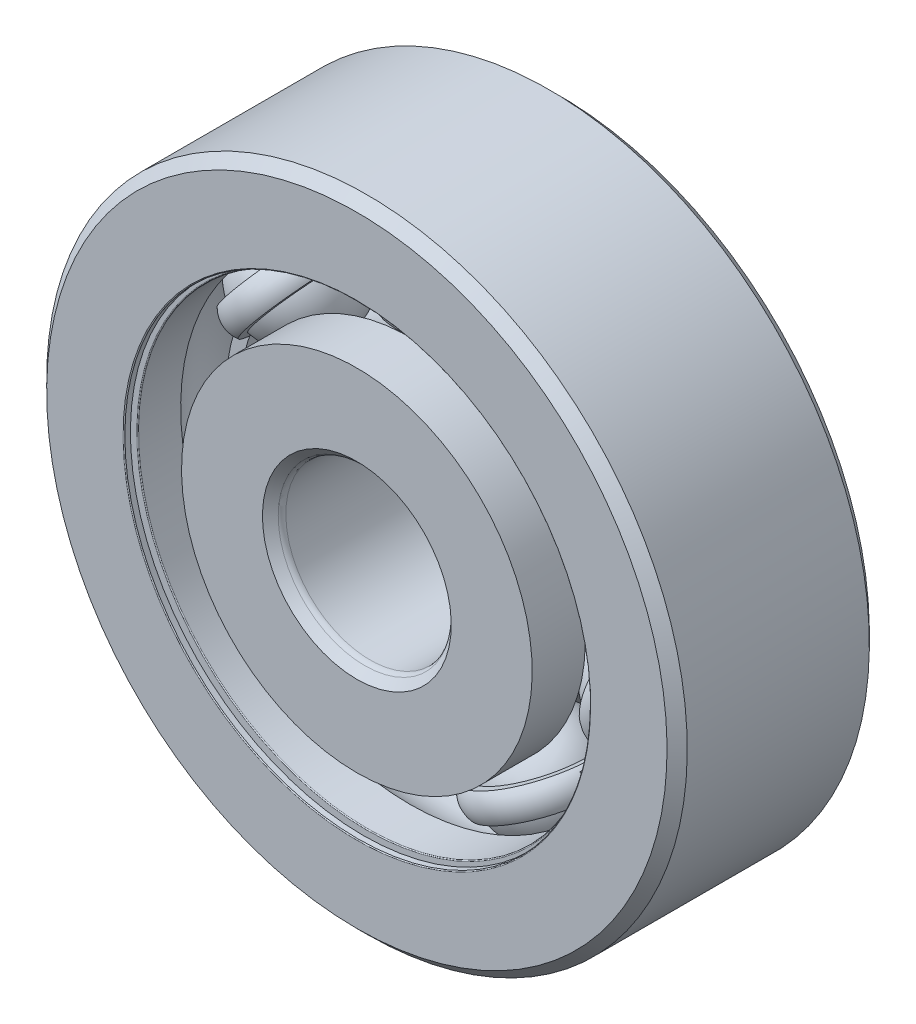
from build123d import *

# Parameters (mm, degrees)
BOSS_EXTRUDE1_DEPTH = 0.5
CIRPATTERN1_COUNT   = 7
CIRPATTERN2_COUNT   = 7
FILLET1_R           = 0.027
FILLET2_R           = 0.225


with BuildPart() as part:
    # Sketch3 → Revolve1 (revolve)
    with BuildSketch(Plane(origin=(0, 0, 0), x_dir=(0, 0, -1), z_dir=(1, 0, 0)), mode=Mode.PRIVATE) as revolve1_sk:
        with BuildLine():
            Line((2.7, 9.5), (3, 9.2))
            Line((3, 9.2), (3, 6.8))
            Line((3, 6.8), (1.425, 6.8))
            ThreePointArc((1.425, 6.8), (0, 7.6342047), (-1.425, 6.8))
            Line((-1.425, 6.8), (-3, 6.8))
            Line((-3, 6.8), (-3, 9.2))
            Line((-3, 9.2), (-2.7, 9.5))
            Line((-2.7, 9.5), (2.7, 9.5))
        make_face()
    revolve(revolve1_sk.sketch.rotate(Axis((0, 0, 3), (0, 0, -1)), 180), axis=Axis((0, 0, 3), (0, 0, -1)))

    # Sketch8 → Cut-Revolve1 (revolve, cut)
    with BuildSketch(Plane(origin=(0, 0, 0), x_dir=(0, 0, -1), z_dir=(1, 0, 0)), mode=Mode.PRIVATE) as cut_revolve1_sk:
        Polygon((-2.808, 6.8), (-2.7, 6.8), (-2.7, 7.7), (-2.808, 7.7), (-2.808, 6.908), (-3, 6.908), (-3, 6.8), align=None)
        Polygon((2.7, 6.8), (2.808, 6.8), (3, 6.8), (3, 6.908), (2.808, 6.908), (2.808, 7.7), (2.7, 7.7), align=None)
    revolve(cut_revolve1_sk.sketch.rotate(Axis((0, 0, 3), (0, 0, -1)), 180), axis=Axis((0, 0, 3), (0, 0, -1)), mode=Mode.SUBTRACT)

    # Fillet1
    fillet1_edges = [part.edges().sort_by_distance(p)[0] for p in [
        (0, 6.908, 3),
        (0, 6.8, 2.7),
        (0, 6.908, -3),
        (0, 6.8, -2.7),
    ]]
    fillet(fillet1_edges, radius=FILLET1_R)


with BuildPart() as body_2:
    # Sketch4 → Revolve2 (revolve)
    with BuildSketch(Plane(origin=(0, 0, 0), x_dir=(0, 0, -1), z_dir=(1, 0, 0)), mode=Mode.PRIVATE) as revolve2_sk:
        with BuildLine():
            Line((-2.7, 2.5), (-3, 2.8))
            Line((-3, 2.8), (-3, 5.2))
            Line((-3, 5.2), (-1.425, 5.2))
            ThreePointArc((-1.425, 5.2), (0, 4.3657953), (1.425, 5.2))
            Line((1.425, 5.2), (3, 5.2))
            Line((3, 5.2), (3, 2.8))
            Line((3, 2.8), (2.7, 2.5))
            Line((2.7, 2.5), (-2.7, 2.5))
        make_face()
    revolve(revolve2_sk.sketch.rotate(Axis((0, 0, 3), (0, 0, -1)), 180), axis=Axis((0, 0, 3), (0, 0, -1)))

    # Fillet2
    fillet2_edges = [body_2.edges().sort_by_distance(p)[0] for p in [
        (0, 2.5, 2.7),
        (0, 2.5, -2.7),
    ]]
    fillet(fillet2_edges, radius=FILLET2_R)


with BuildPart() as body_3:
    # Sketch5 → Revolve3 (revolve)
    with BuildSketch(Plane(origin=(0, 0, 0), x_dir=(0, 0, -1), z_dir=(1, 0, 0))):
        with BuildLine():
            Line((-1.6342047, 6), (1.6342047, 6))
            ThreePointArc((1.6342047, 6), (0, 7.6342047), (-1.6342047, 6))
        make_face()
    revolve(axis=Axis((0, 6, 1.6342047), (0, 0, -1)))


with BuildPart() as body_4:
    # Sketch6 → Revolve4 (revolve)
    with BuildSketch(Plane(origin=(0, 0, 0), x_dir=(0, 0, -1), z_dir=(1, 0, 0))):
        with BuildLine():
            Line((-1.584495188, 6.4), (-1.820412656, 6.4))
            ThreePointArc((-1.820412656, 6.4), (-1.938371391, 6), (-1.820412656, 5.6))
            Line((-1.820412656, 5.6), (-1.584495188, 5.6))
            ThreePointArc((-1.584495188, 5.6), (-1.6342047, 6), (-1.584495188, 6.4))
        make_face()
    revolve4 = revolve(axis=Axis((0, 9.5, 0), (0, -1, 0)))

    # Sketch7 → Boss-Extrude1 (add, symmetric)
    with BuildSketch(Plane.XY):
        with BuildLine():
            Line((4.547477099, 3.914134902), (4.850642239, 4.175077229))
            ThreePointArc((4.850642239, 4.175077229), (2.668286504, 5.81723707), (0, 6.4))
            Line((0, 6.4), (0, 6))
            ThreePointArc((0, 6), (2.501518598, 5.453659753), (4.547477099, 3.914134902))
        make_face()
    boss_extrude1 = extrude(amount=BOSS_EXTRUDE1_DEPTH, both=True)

    # CirPattern2: Revolve4, Boss-Extrude1 ×7 about axis
    cirpattern2_axis = Axis((0, 0, 0), (0, 0, 1))
    add([revolve4.rotate(cirpattern2_axis, i * 360 / CIRPATTERN2_COUNT) for i in range(1, CIRPATTERN2_COUNT)])
    add([boss_extrude1.rotate(cirpattern2_axis, i * 360 / CIRPATTERN2_COUNT) for i in range(1, CIRPATTERN2_COUNT)])


with BuildPart() as cirpattern1_1:
    # CirPattern1: pattern copy
    add(body_3.part.rotate(Axis((0, 0, 0), (0, 0, 1)), 1 * 360 / CIRPATTERN1_COUNT))


with BuildPart() as cirpattern1_2:
    # CirPattern1: pattern copy
    add(body_3.part.rotate(Axis((0, 0, 0), (0, 0, 1)), 2 * 360 / CIRPATTERN1_COUNT))


with BuildPart() as cirpattern1_3:
    # CirPattern1: pattern copy
    add(body_3.part.rotate(Axis((0, 0, 0), (0, 0, 1)), 3 * 360 / CIRPATTERN1_COUNT))


with BuildPart() as cirpattern1_4:
    # CirPattern1: pattern copy
    add(body_3.part.rotate(Axis((0, 0, 0), (0, 0, 1)), 4 * 360 / CIRPATTERN1_COUNT))


with BuildPart() as cirpattern1_5:
    # CirPattern1: pattern copy
    add(body_3.part.rotate(Axis((0, 0, 0), (0, 0, 1)), 5 * 360 / CIRPATTERN1_COUNT))


with BuildPart() as cirpattern1_6:
    # CirPattern1: pattern copy
    add(body_3.part.rotate(Axis((0, 0, 0), (0, 0, 1)), 6 * 360 / CIRPATTERN1_COUNT))


solid = Compound([part.part, body_2.part, body_3.part, body_4.part, cirpattern1_1.part, cirpattern1_2.part, cirpattern1_3.part, cirpattern1_4.part, cirpattern1_5.part, cirpattern1_6.part])
